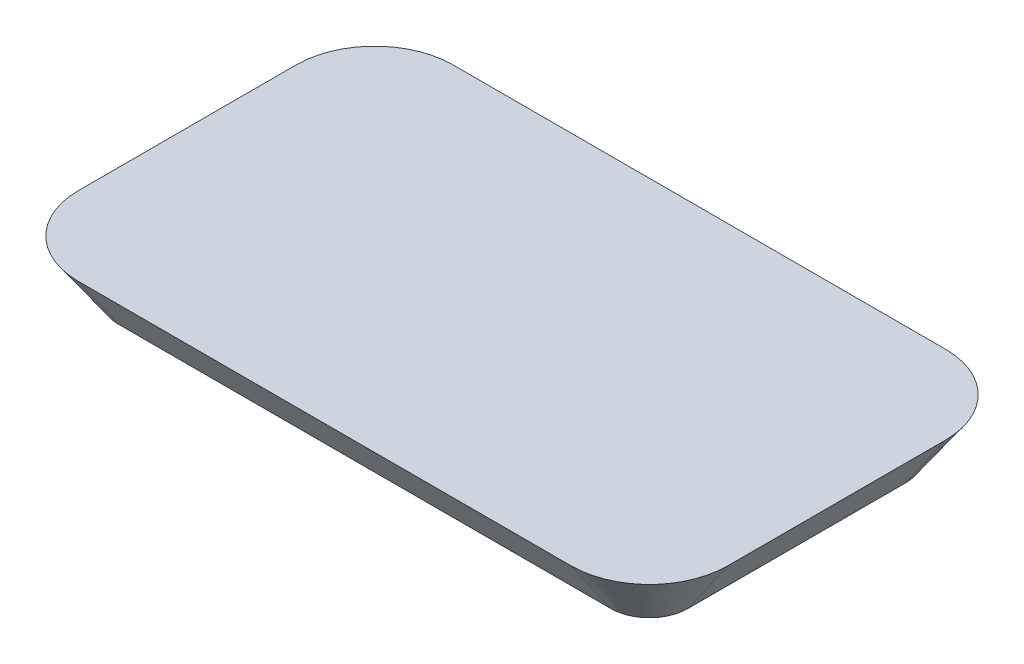
from build123d import *

# Parameters (mm, degrees)
BOSS_EXTRUDE1_DEPTH = 8
BOSS_EXTRUDE1_DRAFT = -35


with BuildPart() as part:
    # Sketch1 → Boss-Extrude1 (with draft: the straight prism first)
    with BuildSketch(Plane(origin=(0, 0, 0), x_dir=(1, 0, 0), z_dir=(0, 1, 0))):
        with BuildLine():
            ThreePointArc((-34.5, 26.25), (-42.278174593, 23.028174593), (-45.5, 15.25))
            Line((-45.5, 15.25), (-45.5, -15.25))
            ThreePointArc((-45.5, -15.25), (-42.278174593, -23.028174593), (-34.5, -26.25))
            Line((-34.5, -26.25), (34.5, -26.25))
            ThreePointArc((34.5, -26.25), (42.278174593, -23.028174593), (45.5, -15.25))
            Line((45.5, -15.25), (45.5, 15.25))
            ThreePointArc((45.5, 15.25), (42.278174593, 23.028174593), (34.5, 26.25))
            Line((34.5, 26.25), (-34.5, 26.25))
        make_face()
    extrude(amount=-BOSS_EXTRUDE1_DEPTH)
    # Boss-Extrude1: the draft: its side faces are tilted about the plane it starts from
    boss_extrude1_sides = [part.faces().sort_by_distance(p)[0] for p in [
        (-42.278174593, -4, -23.028174593),
        (-45.5, -4, 0),
        (-42.278174593, -4, 23.028174593),
        (0, -4, 26.25),
        (42.278174593, -4, 23.028174593),
        (45.5, -4, 0),
        (42.278174593, -4, -23.028174593),
        (0, -4, -26.25),
    ]]
    draft(boss_extrude1_sides, Plane(origin=(0, 0, 0), x_dir=(1, 0, 0), z_dir=(0, 1, 0)), BOSS_EXTRUDE1_DRAFT)


solid = part.part
